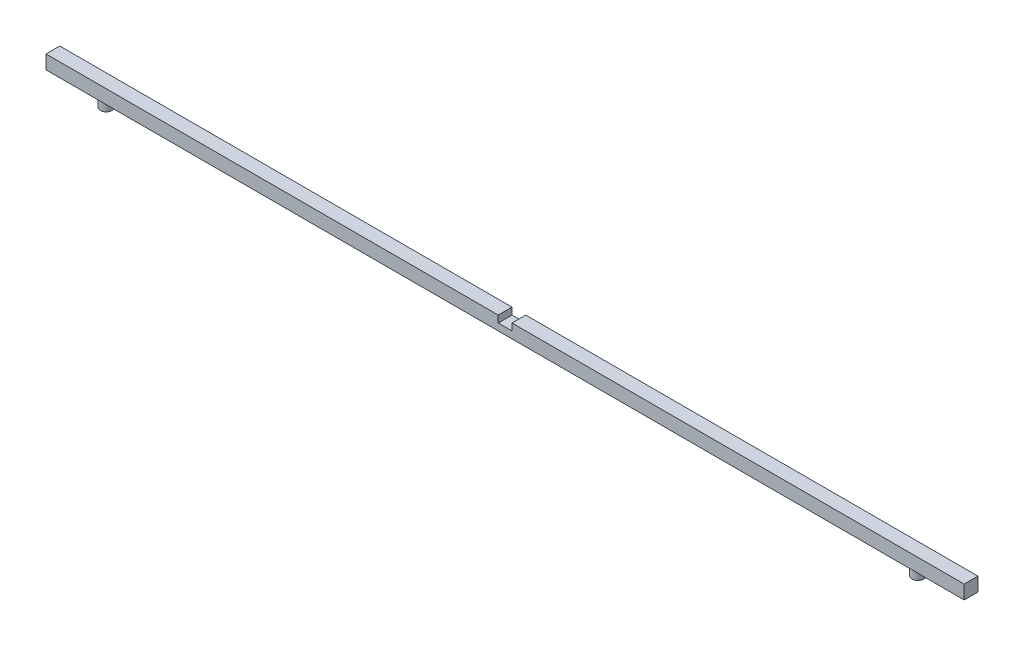
from build123d import *

# Parameters (mm, degrees)
EXTRUDE_1_DEPTH     = 30
SKETCH_3_R          = 10
CUT_EXTRUDE_1_DEPTH = 15
EXTRUDE_START       = 20
SKETCH_4_R          = 12.5
SKETCH_4_R_2        = 10
EXTRUDE_2_DEPTH     = 20


with BuildPart() as part:
    # 草图1 → 凸台-拉伸1 (new body)
    with BuildSketch(Plane.XY):
        Polygon((-1000, 30), (-15, 30), (-15, 15), (15, 15), (15, 30), (1000, 30), (1000, 0), (-1000, 0), align=None)
    extrude(amount=EXTRUDE_1_DEPTH)

    # 草图3 → 切除-拉伸1 (cut)
    with BuildSketch(Plane.XZ):
        with Locations((-883.883476483, 15)):
            Circle(SKETCH_3_R)
        with Locations(Location((883.883476483, 15, 0), (0, 0, 180))):
            Circle(SKETCH_3_R)
    extrude(amount=-CUT_EXTRUDE_1_DEPTH, mode=Mode.SUBTRACT)

    # 草图4 → 凸台-拉伸2 (add)
    # profile 1 of 2: a face of its own
    with BuildSketch(Plane.XZ.offset(EXTRUDE_START)):
        with Locations(Location((-883.883476483, 15, 0), (0, 0, 180))):
            Circle(SKETCH_4_R)
        with Locations((-883.883476483, 15)):
            Circle(SKETCH_4_R_2, mode=Mode.SUBTRACT)
    # profile 2 of 2: a face of its own
    with BuildSketch(Plane.XZ.offset(EXTRUDE_START)):
        with Locations(Location((883.883476483, 15, 0), (0, 0, 180))):
            Circle(SKETCH_4_R)
        with Locations(Location((883.883476483, 15, 0), (0, 0, 180))):
            Circle(SKETCH_4_R_2, mode=Mode.SUBTRACT)
    extrude(amount=-EXTRUDE_2_DEPTH)


solid = part.part
